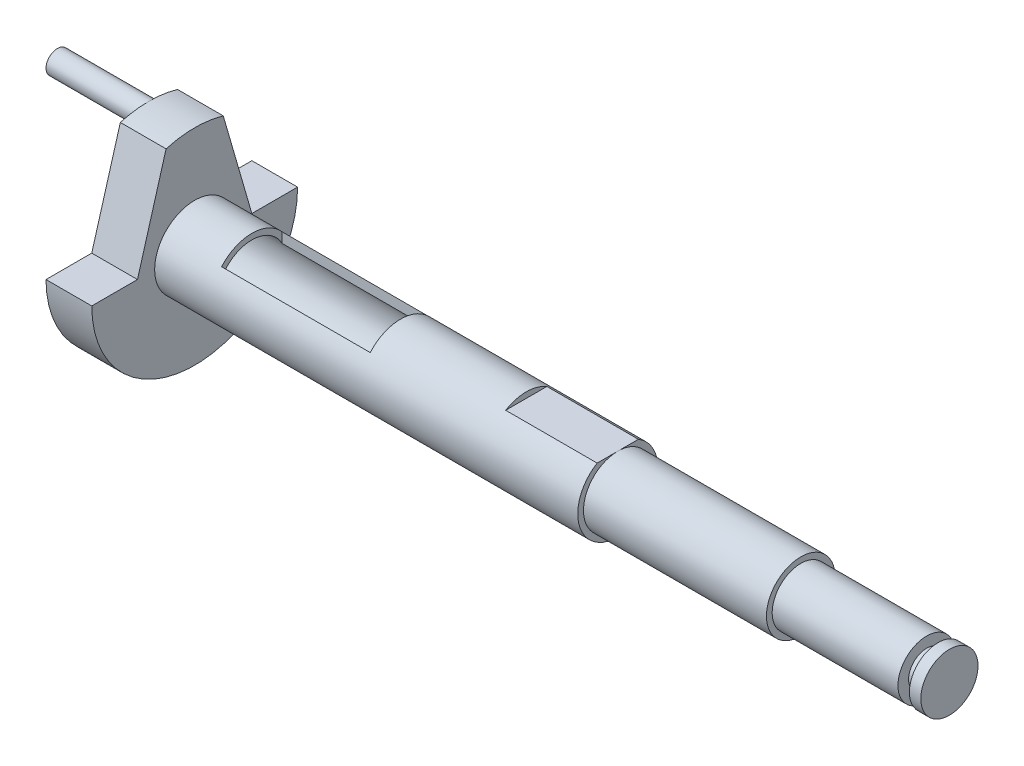
from build123d import *

# Parameters (mm, degrees)
SKETCH1_R           = 2.5
BOSS_EXTRUDE1_DEPTH = 1
SKETCH2_R           = 1.57
BOSS_EXTRUDE2_DEPTH = 1
BOSS_EXTRUDE3_START = 11
SKETCH3_R           = 2.5
BOSS_EXTRUDE3_DEPTH = 11
SKETCH4_R           = 3
BOSS_EXTRUDE4_DEPTH = 16
SKETCH6_R           = 3.5
BOSS_EXTRUDE6_DEPTH = 8
SKETCH7_W           = 8.052083516
SKETCH7_H           = 1.294876405
CUT_EXTRUDE1_DEPTH  = 30.419381367
SKETCH8_R           = 3.5
BOSS_EXTRUDE7_DEPTH = 29
CUT_EXTRUDE2_START  = -18
SKETCH9_R           = 3
CUT_EXTRUDE2_DEPTH  = 18
SKETCH10_W          = 13
SKETCH10_H          = 5.291502622
CUT_EXTRUDE3_DEPTH  = 3
SKETCH11_R          = 9
BOSS_EXTRUDE8_DEPTH = 4
CUT_EXTRUDE4_START  = -4
SKETCH12_R          = 3
CUT_EXTRUDE4_DEPTH  = 4
CUT_EXTRUDE5_START  = -4
CUT_EXTRUDE5_DEPTH  = 4
SKETCH14_R          = 1
BOSS_EXTRUDE9_DEPTH = 8


with BuildPart() as part:
    # Sketch1 → Boss-Extrude1 (new body)
    with BuildSketch(Plane(origin=(0, 0, 0), x_dir=(0, 0, -1), z_dir=(1, 0, 0))):
        Circle(SKETCH1_R)
    extrude(amount=BOSS_EXTRUDE1_DEPTH)

    # Sketch2 → Boss-Extrude2 (add)
    with BuildSketch(Plane.ZY):
        Circle(SKETCH2_R)
    extrude(amount=BOSS_EXTRUDE2_DEPTH)

    # Sketch3 → Boss-Extrude3 (add)
    with BuildSketch(Plane.ZY.offset(1).offset(BOSS_EXTRUDE3_START)):
        with Locations(Location((0, 0, 0), (0, 0, 180))):
            Circle(SKETCH3_R)
    extrude(amount=-BOSS_EXTRUDE3_DEPTH)

    # Sketch4 → Boss-Extrude4 (add)
    with BuildSketch(Plane.ZY.offset(12)):
        Circle(SKETCH4_R)
    extrude(amount=BOSS_EXTRUDE4_DEPTH)

    # Sketch6 → Boss-Extrude6 (add)
    with BuildSketch(Plane.ZY.offset(28)):
        Circle(SKETCH6_R)
    extrude(amount=BOSS_EXTRUDE6_DEPTH)

    # Sketch7 → Cut-Extrude1 (cut, through all)
    with BuildSketch(Plane(origin=(-28, 0, 0), x_dir=(0, 0, -1), z_dir=(1, 0, 0))):
        with Locations((-0.074496348, 3.647438203)):
            Rectangle(SKETCH7_W, SKETCH7_H)
    extrude(amount=-CUT_EXTRUDE1_DEPTH, mode=Mode.SUBTRACT)

    # Sketch8 → Boss-Extrude7 (add)
    with BuildSketch(Plane.ZY.offset(36)):
        with Locations(Location((0, 0, 0), (0, 0, 121.002719134))):
            Circle(SKETCH8_R)
    extrude(amount=BOSS_EXTRUDE7_DEPTH)

    # Sketch9 → Cut-Extrude2 (cut)
    with BuildSketch(Plane.ZY.offset(65).offset(CUT_EXTRUDE2_START)):
        with Locations(Location((0, 0, 0), (0, 0, 90))):
            Circle(SKETCH9_R)
    extrude(amount=CUT_EXTRUDE2_DEPTH, mode=Mode.SUBTRACT)

    # Sketch10 → Cut-Extrude3 (cut)
    with BuildSketch(Plane(origin=(0, 4, 0), x_dir=(1, 0, 0), z_dir=(0, 1, 0))):
        with Locations((-53.5, 0)):
            Rectangle(SKETCH10_W, SKETCH10_H)
    extrude(amount=-CUT_EXTRUDE3_DEPTH, mode=Mode.SUBTRACT)

    # Sketch11 → Boss-Extrude8 (add)
    with BuildSketch(Plane.ZY.offset(65)):
        Circle(SKETCH11_R)
    extrude(amount=BOSS_EXTRUDE8_DEPTH)

    # Sketch12 → Cut-Extrude4 (cut)
    with BuildSketch(Plane.ZY.offset(69).offset(CUT_EXTRUDE4_START)):
        with Locations(Location((0, 0, 0), (0, 0, 90))):
            Circle(SKETCH12_R)
    extrude(amount=CUT_EXTRUDE4_DEPTH, mode=Mode.SUBTRACT)

    # Sketch13 → Cut-Extrude5 (cut)
    with BuildSketch(Plane.ZY.offset(69).offset(CUT_EXTRUDE5_START)):
        with BuildLine():
            ThreePointArc((-2.5, 8.645808233), (-7.193747285, 5.408326913), (-9, 0))
            Line((-9, 0), (-5, 0))
            Line((-5, 0), (-2.5, 8.645808233))
        make_face()
        with BuildLine():
            Line((5, 0), (9, 0))
            ThreePointArc((9, 0), (7.193747285, 5.408326913), (2.5, 8.645808233))
            Line((2.5, 8.645808233), (5, 0))
        make_face()
    extrude(amount=CUT_EXTRUDE5_DEPTH, mode=Mode.SUBTRACT)

    # Sketch14 → Boss-Extrude9 (add)
    with BuildSketch(Plane.ZY.offset(69)):
        with Locations(Location((0, 8, 0), (0, 0, 89.999140318))):
            Circle(SKETCH14_R)
    extrude(amount=BOSS_EXTRUDE9_DEPTH)


solid = part.part
